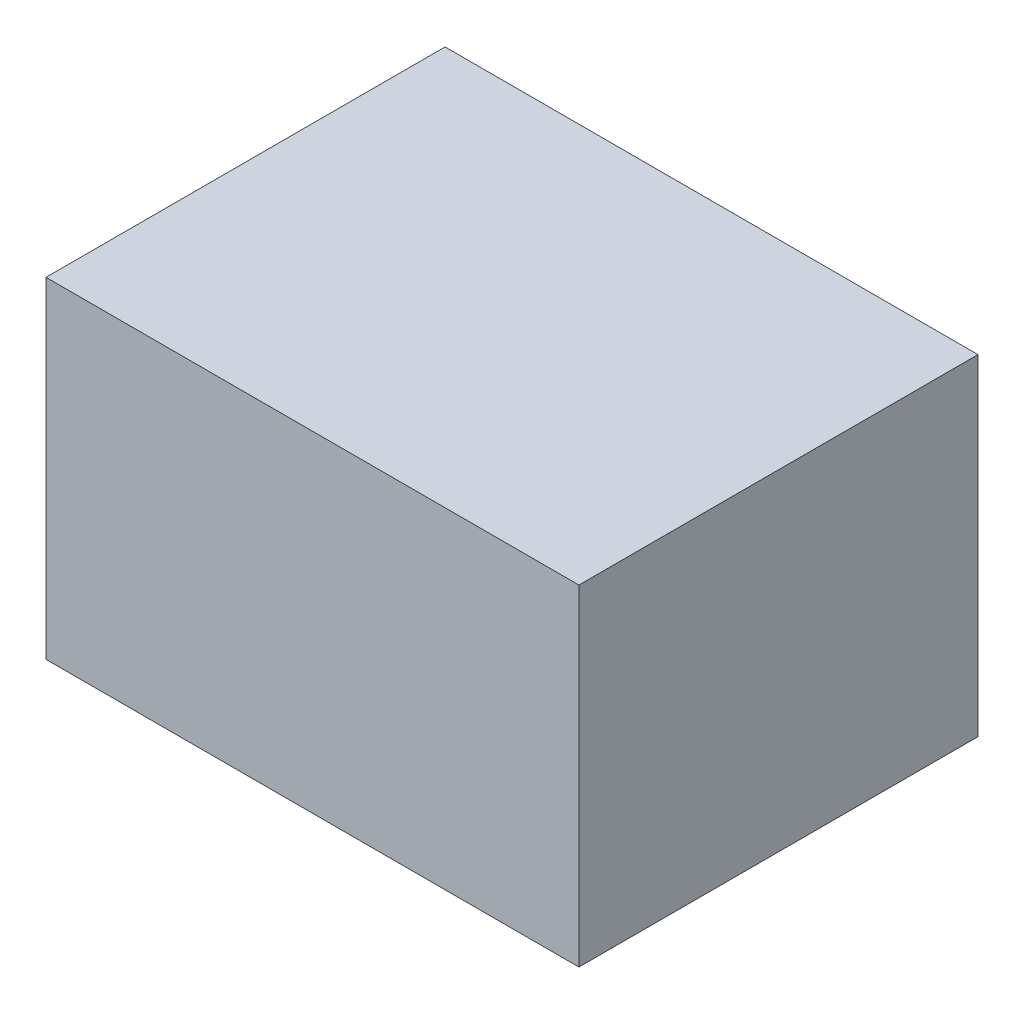
from build123d import *

# Parameters (mm, degrees)
SKETCH1_W           = 21.1
SKETCH1_H           = 13.1
BOSS_EXTRUDE1_DEPTH = 15.8


with BuildPart() as part:
    # Sketch1 → Boss-Extrude1 (new body)
    with BuildSketch(Plane.XY):
        with Locations((10.55, 6.55)):
            Rectangle(SKETCH1_W, SKETCH1_H)
    extrude(amount=BOSS_EXTRUDE1_DEPTH)


solid = part.part
